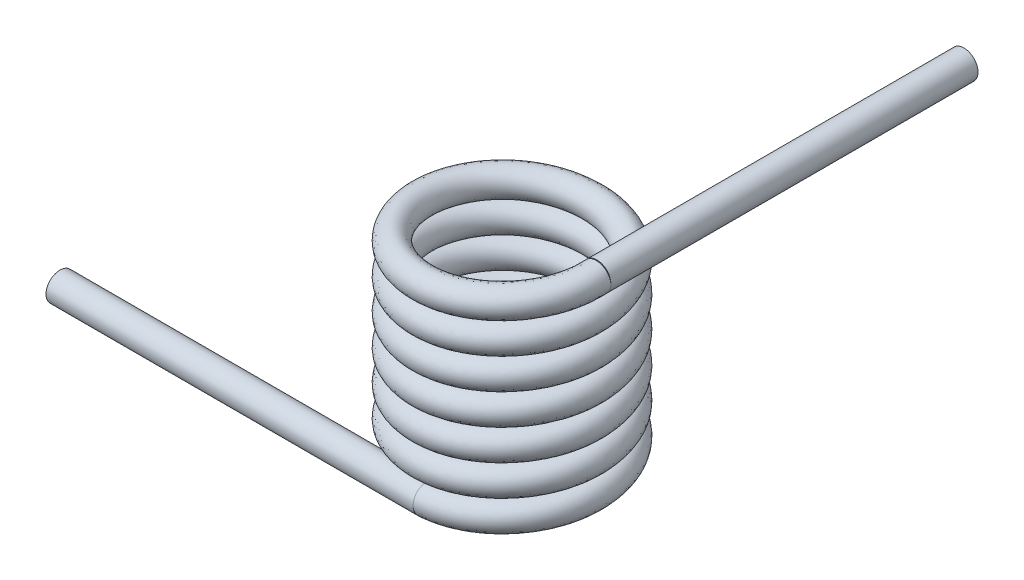
from build123d import *

# Parameters (mm, degrees)
SWEEP1_PROFILE_R = 0.2285
SWEEP2_PROFILE_R = 0.2285
SWEEP7_PROFILE_R = 0.2285


with BuildPart() as part:
    # Sweep1: sweep along a path in Sketch3
    with BuildLine(Plane(origin=(0, 0, 0), x_dir=(1, 0, 0), z_dir=(0, 1, 0))) as sweep1_path:
        Line((0, -1.3885), (-6, -1.3885))
    # Sweep1 profile (on start of the path) → Sweep1 (sweep)
    with BuildSketch(Plane(origin=(0, 0, 1.3885), x_dir=(0, 0, -1), z_dir=(-1, 0, 0))):
        Circle(SWEEP1_PROFILE_R)
    sweep(path=sweep1_path.line)



with BuildPart() as body_2:
    # Sweep2: sweep along a path in Sketch2
    with BuildLine(Plane(origin=(0, 3.143, 0), x_dir=(1, 0, 0), z_dir=(0, 1, 0))) as sweep2_path:
        Line((1.3885, 0), (1.3885, 6))
    # Sweep2 profile (on start of the path) → Sweep2 (sweep)
    with BuildSketch(Plane(origin=(1.3885, 3.143, 0), x_dir=(-1, 0, 0), z_dir=(0, 0, -1))):
        Circle(SWEEP2_PROFILE_R)
    sweep(path=sweep2_path.line)


with BuildPart() as part_1:
    add(part.part)

    add(body_2.part)  # Sweep7 merges body 2
    # Sweep7: sweep along a curve in space
    with BuildLine() as sweep7_path:
        add(Edge.make_bspline(
            [(0, 0, 1.3885), (0.180592481, 0.010409701, 1.3885), (0.545717117, 0.031461079, 1.316203404), (1.007237044, 0.062851672, 1.007378472), (1.316241299, 0.094292231, 0.545189301), (1.424638144, 0.125719402, 0), (1.316206124, 0.15715016, -0.545189301), (1.007377743, 0.188579957, -1.007378472), (0.545189496, 0.220010012, -1.316203404), (-5.2e-08, 0.251439997, -1.424648298), (-0.545189287, 0.282870001, -1.316203404), (-1.007378476, 0.3143, -1.007378472), (-1.316203403, 0.34573, -0.545189301), (-1.424648298, 0.37716, 0), (-1.316203404, 0.40859, 0.545189301), (-1.007378472, 0.44002, 1.007378472), (-0.545189301, 0.47145, 1.316203404), (0, 0.50288, 1.424648298), (0.545189301, 0.53431, 1.316203404), (1.007378472, 0.56574, 1.007378472), (1.316203404, 0.59717, 0.545189301), (1.424648298, 0.6286, 0), (1.316203404, 0.66003, -0.545189301), (1.007378472, 0.69146, -1.007378472), (0.545189301, 0.72289, -1.316203404), (0, 0.75432, -1.424648298), (-0.545189301, 0.78575, -1.316203404), (-1.007378472, 0.81718, -1.007378472), (-1.316203404, 0.84861, -0.545189301), (-1.424648298, 0.88004, 0), (-1.316203404, 0.91147, 0.545189301), (-1.007378472, 0.9429, 1.007378472), (-0.545189301, 0.97433, 1.316203404), (0, 1.00576, 1.424648298), (0.545189301, 1.03719, 1.316203404), (1.007378472, 1.06862, 1.007378472), (1.316203404, 1.10005, 0.545189301), (1.424648298, 1.13148, 0), (1.316203404, 1.16291, -0.545189301), (1.007378472, 1.19434, -1.007378472), (0.545189301, 1.22577, -1.316203404), (0, 1.2572, -1.424648298), (-0.545189301, 1.28863, -1.316203404), (-1.007378472, 1.32006, -1.007378472), (-1.316203404, 1.35149, -0.545189301), (-1.424648298, 1.38292, 0), (-1.316203404, 1.41435, 0.545189301), (-1.007378472, 1.44578, 1.007378472), (-0.545189301, 1.47721, 1.316203404), (0, 1.50864, 1.424648298), (0.545189301, 1.54007, 1.316203404), (1.007378472, 1.5715, 1.007378472), (1.316203404, 1.60293, 0.545189301), (1.424648298, 1.63436, 0), (1.316203404, 1.66579, -0.545189301), (1.007378472, 1.69722, -1.007378472), (0.545189301, 1.72865, -1.316203404), (0, 1.76008, -1.424648298), (-0.545189301, 1.79151, -1.316203404), (-1.007378472, 1.82294, -1.007378472), (-1.316203404, 1.85437, -0.545189301), (-1.424648298, 1.8858, 0), (-1.316203404, 1.91723, 0.545189301), (-1.007378472, 1.94866, 1.007378472), (-0.545189301, 1.98009, 1.316203404), (0, 2.01152, 1.424648298), (0.545189301, 2.04295, 1.316203404), (1.007378472, 2.07438, 1.007378472), (1.316203404, 2.10581, 0.545189301), (1.424648298, 2.13724, 0), (1.316203404, 2.16867, -0.545189301), (1.007378472, 2.2001, -1.007378472), (0.545189301, 2.23153, -1.316203404), (0, 2.26296, -1.424648298), (-0.545189301, 2.29439, -1.316203404), (-1.007378472, 2.32582, -1.007378472), (-1.316203404, 2.35725, -0.545189301), (-1.424648298, 2.38868, 0), (-1.316203404, 2.42011, 0.545189301), (-1.007378472, 2.45154, 1.007378472), (-0.545189301, 2.48297, 1.316203404), (0, 2.5144, 1.424648298), (0.545189301, 2.54583, 1.316203404), (1.007378472, 2.57726, 1.007378472), (1.316203404, 2.60869, 0.545189301), (1.424648298, 2.64012, 0), (1.316203404, 2.67155, -0.545189301), (1.007378472, 2.70298, -1.007378472), (0.545189301, 2.73441, -1.316203404), (0, 2.76584, -1.424648298), (-0.545189301, 2.79727, -1.316203403), (-1.007378472, 2.8287, -1.007378476), (-1.316203404, 2.860129999, -0.545189287), (-1.424648298, 2.891560003, -5.2e-08), (-1.316203404, 2.922989988, 0.545189496), (-1.007378472, 2.954420043, 1.007377743), (-0.545189301, 2.98584984, 1.316206124), (0, 3.017280598, 1.424638144), (0.545189301, 3.048707769, 1.316241299), (1.007378472, 3.080148328, 1.007237044), (1.316203404, 3.111538921, 0.545717117), (1.3885, 3.132590299, 0.180592481), (1.3885, 3.143, 0)],
            knots=[0, 0, 0, 0, 0.01, 0.02, 0.03, 0.04, 0.05, 0.06, 0.07, 0.08, 0.09, 0.1, 0.11, 0.12, 0.13, 0.14, 0.15, 0.16, 0.17, 0.18, 0.19, 0.2, 0.21, 0.22, 0.23, 0.24, 0.25, 0.26, 0.27, 0.28, 0.29, 0.3, 0.31, 0.32, 0.33, 0.34, 0.35, 0.36, 0.37, 0.38, 0.39, 0.4, 0.41, 0.42, 0.43, 0.44, 0.45, 0.46, 0.47, 0.48, 0.49, 0.5, 0.51, 0.52, 0.53, 0.54, 0.55, 0.56, 0.57, 0.58, 0.59, 0.6, 0.61, 0.62, 0.63, 0.64, 0.65, 0.66, 0.67, 0.68, 0.69, 0.7, 0.71, 0.72, 0.73, 0.74, 0.75, 0.76, 0.77, 0.78, 0.79, 0.8, 0.81, 0.82, 0.83, 0.84, 0.85, 0.86, 0.87, 0.88, 0.89, 0.9, 0.91, 0.92, 0.93, 0.94, 0.95, 0.96, 0.97, 0.98, 0.99, 1, 1, 1, 1], degree=3))
    # Sweep7 profile (on start of the path) → Sweep7 (sweep)
    with BuildSketch(Plane(origin=(0, 0, 1.3885), x_dir=(-0.05754642054291843, 0.9983428316378585, 0), z_dir=(0.9983428316378585, 0.05754642054291843, 0))):
        Circle(SWEEP7_PROFILE_R)
    sweep(path=sweep7_path.line, is_frenet=True)


solid = part_1.part
